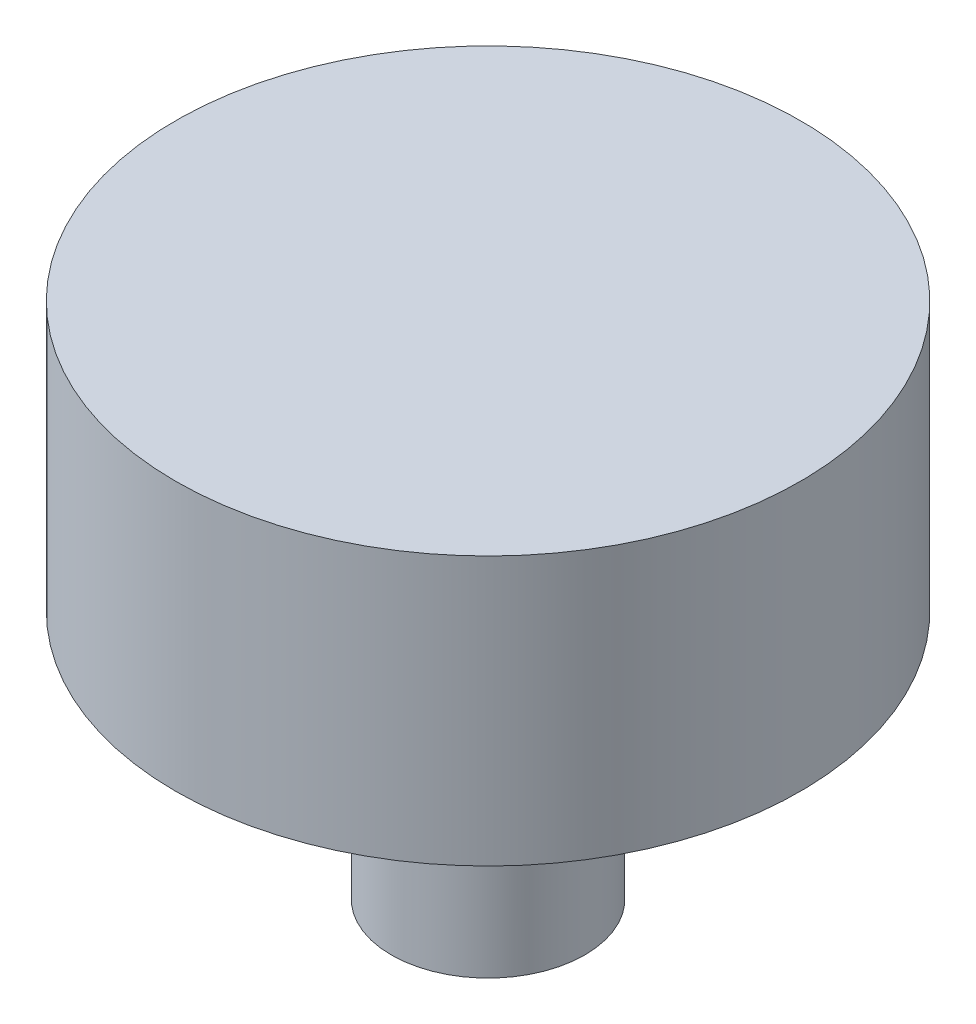
from build123d import *

# Parameters (mm, degrees)
SKETCH1_R           = 20.701
BOSS_EXTRUDE1_DEPTH = 17.7927
SKETCH3_R           = 6.4135
BOSS_EXTRUDE2_DEPTH = 16.5354


with BuildPart() as part:
    # Sketch1 → Boss-Extrude1 (new body)
    with BuildSketch(Plane(origin=(0, 0, 0), x_dir=(1, 0, 0), z_dir=(0, 1, 0))):
        with Locations(Location((0, 0, 0), (0, 0, 270))):
            Circle(SKETCH1_R)
    extrude(amount=BOSS_EXTRUDE1_DEPTH)

    # Sketch3 → Boss-Extrude2 (add)
    with BuildSketch(Plane.XZ):
        with Locations(Location((0, 0, 0), (0, 0, 90))):
            Circle(SKETCH3_R)
    extrude(amount=BOSS_EXTRUDE2_DEPTH)


solid = part.part
